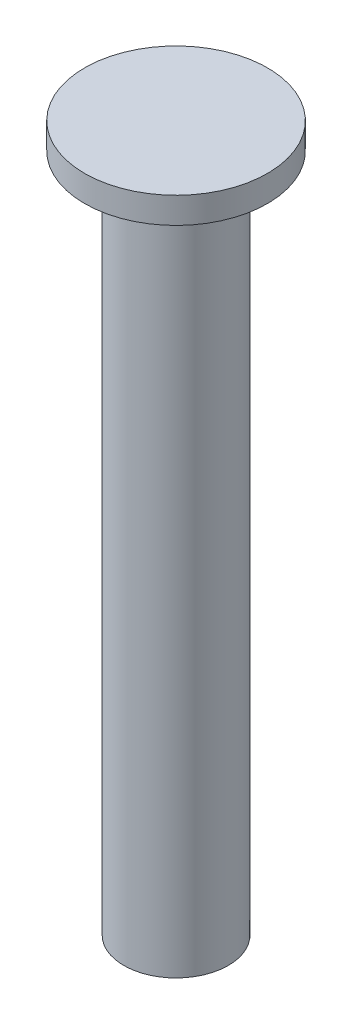
from build123d import *

# Parameters (mm, degrees)
SKETCH1_R           = 2
BOSS_EXTRUDE1_DEPTH = 26
SKETCH2_R           = 3.5
BOSS_EXTRUDE2_DEPTH = 1


with BuildPart() as part:
    # Sketch1 → Boss-Extrude1 (new body)
    with BuildSketch(Plane(origin=(0, 0, 0), x_dir=(1, 0, 0), z_dir=(0, 1, 0))):
        with Locations(Location((0, 0, 0), (0, 0, 90))):
            Circle(SKETCH1_R)
    extrude(amount=BOSS_EXTRUDE1_DEPTH)

    # Sketch2 → Boss-Extrude2 (add)
    with BuildSketch(Plane(origin=(0, 26, 0), x_dir=(1, 0, 0), z_dir=(0, 1, 0))):
        with Locations(Location((0, 0, 0), (0, 0, 270))):
            Circle(SKETCH2_R)
    extrude(amount=BOSS_EXTRUDE2_DEPTH)


solid = part.part
